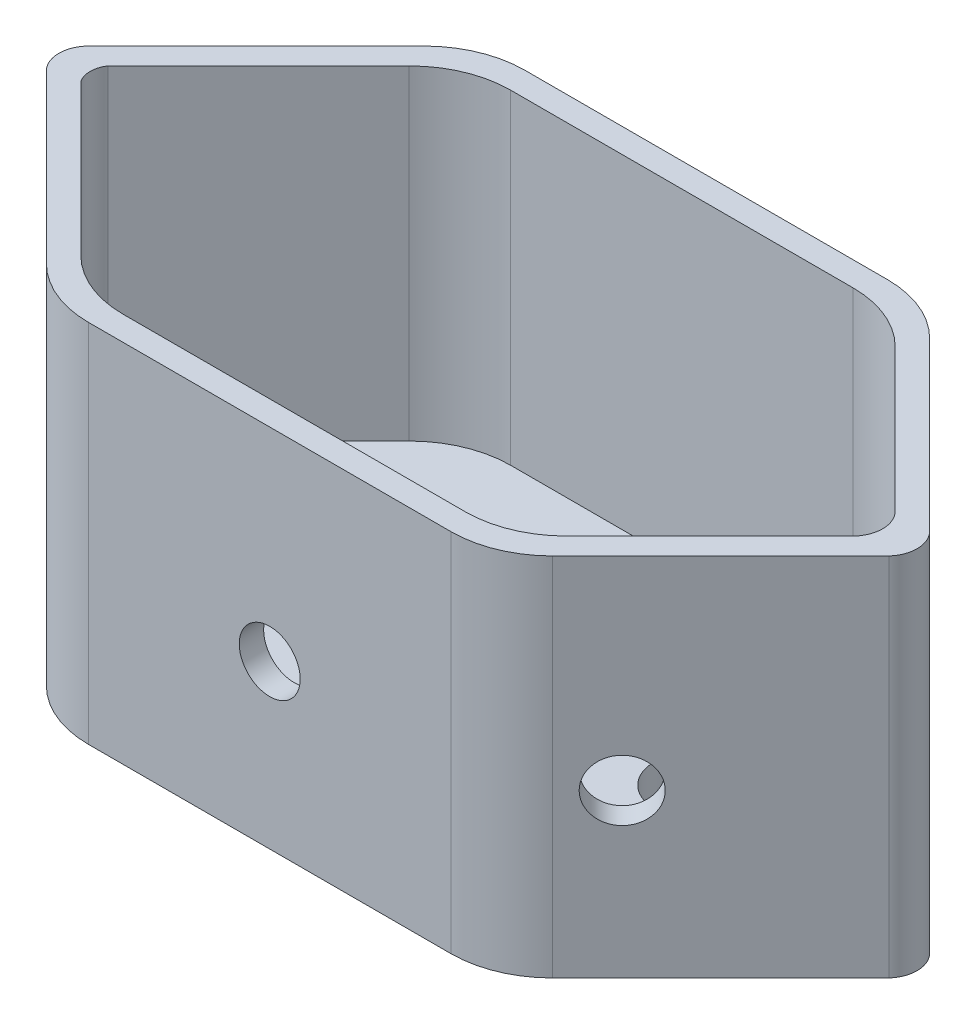
from build123d import *

# Parameters (mm, degrees)
RESSALTO_EXTRUS_O1_DEPTH = 18
CORTE_EXTRUS_O1_DEPTH    = 16
ESBO_O3_R                = 1.5
CORTE_EXTRUS_O2_DEPTH    = 16
ESBO_O4_R                = 1.5
CORTE_EXTRUS_O5_DEPTH    = 5
ESBO_O11_R               = 1.5
CORTE_EXTRUS_O6_DEPTH    = 5
ESBO_O16_R               = 2
CORTE_EXTRUS_O7_DEPTH    = 5
ESBO_O17_R               = 1.25
CORTE_EXTRUS_O8_DEPTH    = 10
FILETE1_R                = 5
FILETE2_R                = 5
FILETE3_R                = 5
FILETE4_R                = 5
FILETE5_R                = 5
FILETE6_R                = 5
FILETE7_R                = 5
FILETE8_R                = 5


with BuildPart() as part:
    # Esboço1 → Ressalto-extrusão1 (new body)
    with BuildSketch(Plane(origin=(0, 0, 0), x_dir=(1, 0, 0), z_dir=(0, 1, 0))):
        with BuildLine():
            ThreePointArc((-20.749133867, -1.000866133), (-21.131951371, -0.000598593), (-20.75, 1))
            Line((-20.75, 1), (-11, 10.75))
            Line((-11, 10.75), (11, 10.75))
            Line((11, 10.75), (20.75, 1))
            ThreePointArc((20.75, 1), (21.131966011, 0), (20.750111133, -0.999888867))
            Line((20.750111133, -0.999888867), (11, -10.75))
            Line((11, -10.75), (-11, -10.75))
            Line((-11, -10.75), (-20.749133867, -1.000866133))
        make_face()
    extrude(amount=RESSALTO_EXTRUS_O1_DEPTH)

    # Esboço2 → Corte-extrusão1 (cut)
    with BuildSketch(Plane(origin=(0, 18, 0), x_dir=(1, 0, 0), z_dir=(0, 1, 0))):
        with BuildLine():
            Line((9.972089297, 9.55), (-10.502943725, 9.55))
            Line((-10.502943725, 9.55), (-19.052943725, 1))
            Line((-19.052943725, 1), (-19.389618767, 0.663324958))
            ThreePointArc((-19.389618767, 0.663324958), (-19.589618767, 0), (-19.389618767, -0.663324958))
            Line((-19.389618767, -0.663324958), (-19.052943725, -1))
            Line((-19.052943725, -1), (-10.502943725, -9.55))
            Line((-10.502943725, -9.55), (10.502943725, -9.55))
            Line((10.502943725, -9.55), (19.052943725, -1))
            ThreePointArc((19.052943725, -1), (19.434909736, 0), (19.052943725, 1))
            Line((19.052943725, 1), (11.538307765, 8.51463596))
            Line((11.538307765, 8.51463596), (10.502943725, 9.55))
            Line((10.502943725, 9.55), (9.972089297, 9.55))
        make_face()
    extrude(amount=-CORTE_EXTRUS_O1_DEPTH, mode=Mode.SUBTRACT)

    # Esboço3 → Corte-extrusão2 (cut)
    with BuildSketch(Plane(origin=(0, 0, 9.55), x_dir=(-1, 0, 0), z_dir=(0, 0, -1))):
        with Locations((0, 8)):
            Circle(ESBO_O3_R)
    extrude(amount=-CORTE_EXTRUS_O2_DEPTH, mode=Mode.SUBTRACT)

    # Esboço4 → Corte-extrusão5 (cut)
    with BuildSketch(Plane(origin=(10.026471863, 0, 10.026471863), x_dir=(-0.7071067811865475, 0, 0.7071067811865477), z_dir=(-0.7071067811865477, 0, -0.7071067811865475))):
        with Locations((-4.67383297, 8)):
            Circle(ESBO_O4_R)
    extrude(amount=-CORTE_EXTRUS_O5_DEPTH, mode=Mode.SUBTRACT)

    # Esboço11 → Corte-extrusão6 (cut)
    with BuildSketch(Plane(origin=(-10.026471863, 0, 10.026471863), x_dir=(-0.7071067811865477, 0, -0.7071067811865474), z_dir=(0.7071067811865474, 0, -0.7071067811865477))):
        with Locations((4.67383297, 8)):
            Circle(ESBO_O11_R)
    extrude(amount=-CORTE_EXTRUS_O6_DEPTH, mode=Mode.SUBTRACT)

    # Esboço16 → Corte-extrusão7 (cut)
    with BuildSketch(Plane(origin=(0, 2, 0), x_dir=(1, 0, 0), z_dir=(0, 1, 0))):
        with Locations(Location((-9.75, 0.45, 0), (0, 0, 270))):
            Circle(ESBO_O16_R)
        with Locations(Location((9.75, 0.45, 0), (0, 0, 270))):
            Circle(ESBO_O16_R)
        with Locations(Location((0, 3.45, 0), (0, 0, 270))):
            Circle(ESBO_O16_R)
    extrude(amount=-CORTE_EXTRUS_O7_DEPTH, mode=Mode.SUBTRACT)

    # Esboço17 → Corte-extrusão8 (cut)
    with BuildSketch(Plane(origin=(0, 2, 0), x_dir=(1, 0, 0), z_dir=(0, 1, 0))):
        with Locations(Location((-6, -6.55, 0), (0, 0, 270))):
            Circle(ESBO_O17_R)
        with Locations(Location((6, -6.55, 0), (0, 0, 270))):
            Circle(ESBO_O17_R)
    extrude(amount=-CORTE_EXTRUS_O8_DEPTH, mode=Mode.SUBTRACT)

    # Filete1
    filete1_edges = [part.edges().sort_by_distance(p)[0] for p in [
        (-10.502943725, 10, -9.55),
    ]]
    fillet(filete1_edges, radius=FILETE1_R)

    # Filete2
    filete2_edges = [part.edges().sort_by_distance(p)[0] for p in [
        (10.502943725, 10, -9.55),
    ]]
    fillet(filete2_edges, radius=FILETE2_R)

    # Filete3
    filete3_edges = [part.edges().sort_by_distance(p)[0] for p in [
        (-10.502943725, 10, 9.55),
    ]]
    fillet(filete3_edges, radius=FILETE3_R)

    # Filete4
    filete4_edges = [part.edges().sort_by_distance(p)[0] for p in [
        (10.502943725, 10, 9.55),
    ]]
    fillet(filete4_edges, radius=FILETE4_R)

    # Filete5
    filete5_edges = [part.edges().sort_by_distance(p)[0] for p in [
        (-11, 9, -10.75),
    ]]
    fillet(filete5_edges, radius=FILETE5_R)

    # Filete6
    filete6_edges = [part.edges().sort_by_distance(p)[0] for p in [
        (11, 9, -10.75),
    ]]
    fillet(filete6_edges, radius=FILETE6_R)

    # Filete7
    filete7_edges = [part.edges().sort_by_distance(p)[0] for p in [
        (-11, 9, 10.75),
    ]]
    fillet(filete7_edges, radius=FILETE7_R)

    # Filete8
    filete8_edges = [part.edges().sort_by_distance(p)[0] for p in [
        (11, 9, 10.75),
    ]]
    fillet(filete8_edges, radius=FILETE8_R)


solid = part.part
